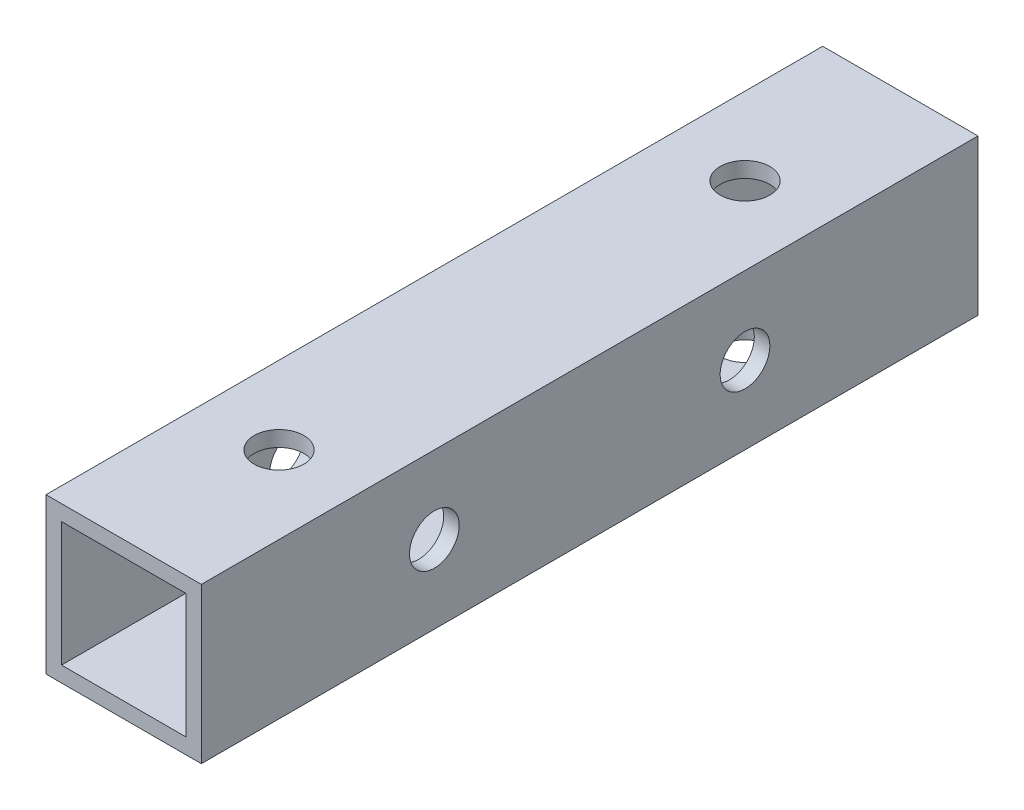
from build123d import *

# Parameters (mm, degrees)
SKETCH_284_W          = 10
SKETCH_284_H          = 10
SKETCH_284_W_2        = 8
SKETCH_284_H_2        = 8
EXTRUDE_341_DEPTH     = 50
SKETCH_413_R          = 1.6
CUT_EXTRUDE_806_DEPTH = 52.23475383
SKETCH_611_R          = 1.6
CUT_EXTRUDE_850_DEPTH = 52.23475383


with BuildPart() as part:
    # Sketch 284 → Extrude 341 (new body)
    with BuildSketch(Plane.XY):
        Rectangle(SKETCH_284_W, SKETCH_284_H)
        Rectangle(SKETCH_284_W_2, SKETCH_284_H_2, mode=Mode.SUBTRACT)
    extrude(amount=EXTRUDE_341_DEPTH)

    # Sketch 413 → Cut-Extrude 806 (cut, through all)
    with BuildSketch(Plane(origin=(0, 5, 0), x_dir=(1, 0, 0), z_dir=(0, 1, 0))):
        with Locations(Location((0, -10, 0), (0, 0, 270))):
            Circle(SKETCH_413_R)
        with Locations(Location((0, -40, 0), (0, 0, 270))):
            Circle(SKETCH_413_R)
    extrude(amount=-CUT_EXTRUDE_806_DEPTH, mode=Mode.SUBTRACT)

    # Sketch 611 → Cut-Extrude 850 (cut, through all)
    with BuildSketch(Plane(origin=(5, 0, 0), x_dir=(0, 0, -1), z_dir=(1, 0, 0))):
        with Locations((-15, 0)):
            Circle(SKETCH_611_R)
        with Locations((-35, 0)):
            Circle(SKETCH_611_R)
    extrude(amount=-CUT_EXTRUDE_850_DEPTH, mode=Mode.SUBTRACT)


solid = part.part
